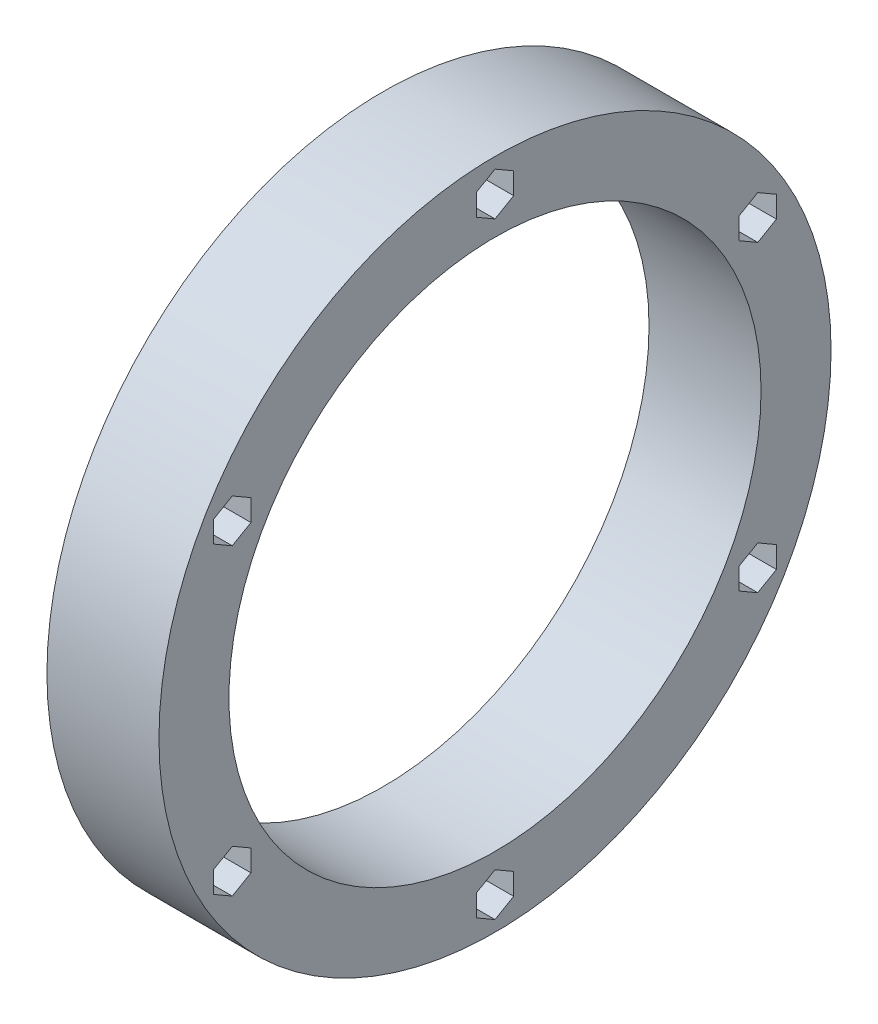
from build123d import *

# Parameters (mm, degrees)
SKETCH1_R           = 72
SKETCH1_R_2         = 57
BOSS_EXTRUDE1_DEPTH = 24
CUT_EXTRUDE1_DEPTH  = 24


with BuildPart() as part:
    # Sketch1 → Boss-Extrude1 (new body)
    with BuildSketch(Plane(origin=(0, 0, 0), x_dir=(0, 0, -1), z_dir=(1, 0, 0))):
        Circle(SKETCH1_R)
        Circle(SKETCH1_R_2, mode=Mode.SUBTRACT)
    extrude(amount=BOSS_EXTRUDE1_DEPTH)

    # Sketch2 → Cut-Extrude1 (cut)
    with BuildSketch(Plane(origin=(24, 0, 0), x_dir=(0, 0, -1), z_dir=(1, 0, 0))):
        Polygon((52.291651246, 30.190598923), (56.291651246, 27.881197846), (60.291651246, 30.190598923), (60.291651246, 34.809401077), (56.291651246, 37.118802154), (52.291651246, 34.809401077), align=None)
        Polygon((0, 60.381197846), (4, 62.690598923), (4, 67.309401077), (0, 69.618802154), (-4, 67.309401077), (-4, 62.690598923), align=None)
        Polygon((52.291651246, -30.190598923), (52.291651246, -34.809401077), (56.291651246, -37.118802154), (60.291651246, -34.809401077), (60.291651246, -30.190598923), (56.291651246, -27.881197846), align=None)
        Polygon((0, -60.381197846), (-4, -62.690598923), (-4, -67.309401077), (0, -69.618802154), (4, -67.309401077), (4, -62.690598923), align=None)
        Polygon((-52.291651246, -30.190598923), (-56.291651246, -27.881197846), (-60.291651246, -30.190598923), (-60.291651246, -34.809401077), (-56.291651246, -37.118802154), (-52.291651246, -34.809401077), align=None)
        Polygon((-52.291651246, 30.190598923), (-52.291651246, 34.809401077), (-56.291651246, 37.118802154), (-60.291651246, 34.809401077), (-60.291651246, 30.190598923), (-56.291651246, 27.881197846), align=None)
    extrude(amount=-CUT_EXTRUDE1_DEPTH, mode=Mode.SUBTRACT)


solid = part.part
